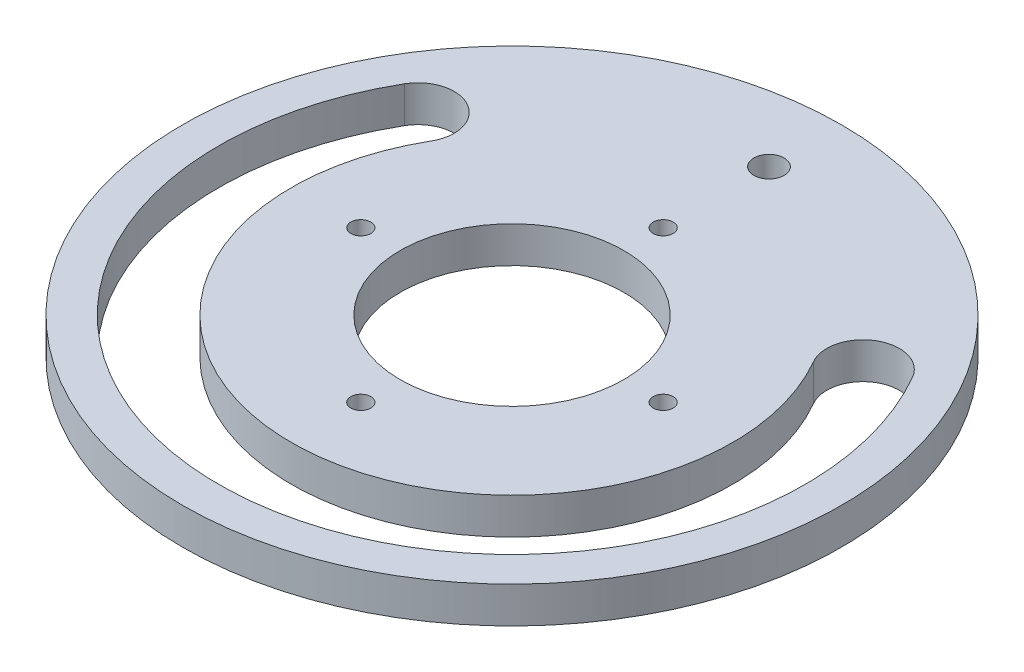
from build123d import *

# Parameters (mm, degrees)
SKETCH_1_R          = 54.5
EXTRUDE_1_DEPTH     = 6
SKETCH_2_R          = 2.5
CUT_EXTRUDE_1_DEPTH = 6
SKETCH_3_R          = 18.5
SKETCH_3_R_2        = 1.65
CUT_EXTRUDE_2_DEPTH = 6


with BuildPart() as part:
    # Эскиз1 → Бобышка-Вытянуть1 (new body)
    with BuildSketch(Plane(origin=(0, 0, 0), x_dir=(1, 0, 0), z_dir=(0, 1, 0))):
        with Locations(Location((0, 0, 0), (0, 0, 270))):
            Circle(SKETCH_1_R)
    extrude(amount=EXTRUDE_1_DEPTH)

    # Эскиз2 → Вырез-Вытянуть1 (cut)
    with BuildSketch(Plane(origin=(0, 6, 0), x_dir=(1, 0, 0), z_dir=(0, 1, 0))):
        with Locations(Location((0, 42.5, 0), (0, 0, 270))):
            Circle(SKETCH_2_R)
        with BuildLine():
            ThreePointArc((-42.002232084, 24.25), (0, -48.5), (42.002232084, 24.25))
            ThreePointArc((42.002232084, 24.25), (33.806079661, 26.446152423), (31.609927238, 18.25))
            ThreePointArc((31.609927238, 18.25), (0, -36.5), (-31.609927238, 18.25))
            ThreePointArc((-31.609927238, 18.25), (-33.806079661, 26.446152423), (-42.002232084, 24.25))
        make_face()
    extrude(amount=-CUT_EXTRUDE_1_DEPTH, mode=Mode.SUBTRACT)

    # Эскиз3 → Вырез-Вытянуть2 (cut)
    with BuildSketch(Plane(origin=(0, 6, 0), x_dir=(1, 0, 0), z_dir=(0, 1, 0))):
        with Locations(Location((0, 0, 0), (0, 0, 270))):
            Circle(SKETCH_3_R)
        with Locations(Location((0, 25, 0), (0, 0, 270))):
            Circle(SKETCH_3_R_2)
        with Locations(Location((-25, 0, 0), (0, 0, 270))):
            Circle(SKETCH_3_R_2)
        with Locations(Location((0, -25, 0), (0, 0, 270))):
            Circle(SKETCH_3_R_2)
        with Locations(Location((25, 0, 0), (0, 0, 270))):
            Circle(SKETCH_3_R_2)
    extrude(amount=-CUT_EXTRUDE_2_DEPTH, mode=Mode.SUBTRACT)


solid = part.part
